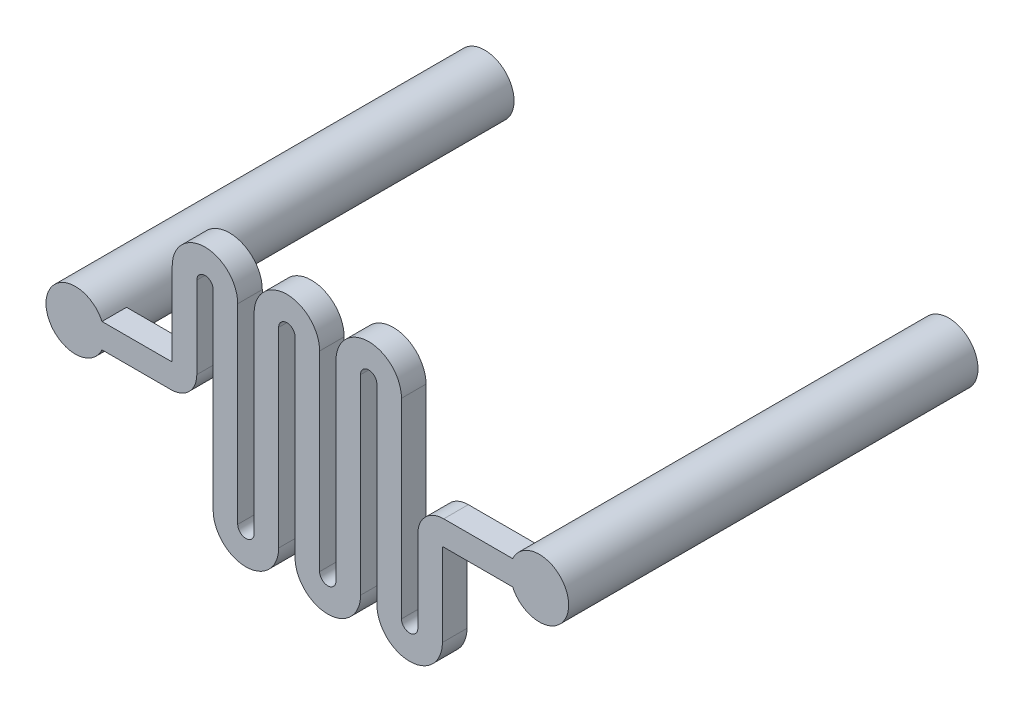
from build123d import *

# Parameters (mm, degrees)
BOSS_EXTRUDE1_DEPTH = 1.8
SKETCH3_W           = 2.15
SKETCH3_H           = 30
SKETCH4_W           = 2.15
SKETCH4_H           = 30
SKETCH5_R           = 1.5
CUT_EXTRUDE1_DEPTH  = 28


with BuildPart() as part:
    # Sketch2 → Boss-Extrude1 (new body)
    with BuildSketch(Plane.XY):
        with BuildLine():
            Line((-20.5, -0.9), (-13.5, -0.9))
            ThreePointArc((-13.5, -0.9), (-12.156497116, -0.343502884), (-11.6, 1))
            Line((-11.6, 1), (-11.6, 7))
            ThreePointArc((-11.6, 7), (-11, 7.6), (-10.4, 7))
            Line((-10.4, 7), (-10.4, 0))
            Line((-10.4, 0), (-10.4, -7))
            ThreePointArc((-10.4, -7), (-8, -9.4), (-5.6, -7))
            Line((-5.6, -7), (-5.6, 0))
            Line((-5.6, 0), (-5.6, 7))
            ThreePointArc((-5.6, 7), (-5, 7.6), (-4.4, 7))
            Line((-4.4, 7), (-4.4, 0))
            Line((-4.4, 0), (-4.4, -7))
            ThreePointArc((-4.4, -7), (-2, -9.4), (0.4, -7))
            Line((0.4, -7), (0.4, 0))
            Line((0.4, 0), (0.4, 7))
            ThreePointArc((0.4, 7), (1, 7.6), (1.6, 7))
            Line((1.6, 7), (1.6, 0))
            Line((1.6, 0), (1.6, -7))
            ThreePointArc((1.6, -7), (4, -9.4), (6.4, -7))
            Line((6.4, -7), (6.4, -1))
            ThreePointArc((6.4, -1), (6.429289322, -0.929289322), (6.5, -0.9))
            Line((6.5, -0.9), (13.5, -0.9))
            ThreePointArc((13.5, -0.9), (14.4, 0), (13.5, 0.9))
            Line((13.5, 0.9), (6.5, 0.9))
            ThreePointArc((6.5, 0.9), (5.156497116, 0.343502884), (4.6, -1))
            Line((4.6, -1), (4.6, -7))
            ThreePointArc((4.6, -7), (4, -7.6), (3.4, -7))
            Line((3.4, -7), (3.4, 0))
            Line((3.4, 0), (3.4, 7))
            ThreePointArc((3.4, 7), (1, 9.4), (-1.4, 7))
            Line((-1.4, 7), (-1.4, 0))
            Line((-1.4, 0), (-1.4, -7))
            ThreePointArc((-1.4, -7), (-2, -7.6), (-2.6, -7))
            Line((-2.6, -7), (-2.6, 0))
            Line((-2.6, 0), (-2.6, 7))
            ThreePointArc((-2.6, 7), (-5, 9.4), (-7.4, 7))
            Line((-7.4, 7), (-7.4, 0))
            Line((-7.4, 0), (-7.4, -7))
            ThreePointArc((-7.4, -7), (-8, -7.6), (-8.6, -7))
            Line((-8.6, -7), (-8.6, 0))
            Line((-8.6, 0), (-8.6, 7))
            ThreePointArc((-8.6, 7), (-11, 9.4), (-13.4, 7))
            Line((-13.4, 7), (-13.4, 1))
            ThreePointArc((-13.4, 1), (-13.429289322, 0.929289322), (-13.5, 0.9))
            Line((-13.5, 0.9), (-20.5, 0.9))
            ThreePointArc((-20.5, 0.9), (-21.4, 0), (-20.5, -0.9))
        make_face()
    extrude(amount=BOSS_EXTRUDE1_DEPTH)

    # Sketch3 → Revolve1 (revolve)
    with BuildSketch(Plane(origin=(0, 0, 0), x_dir=(1, 0, 0), z_dir=(0, 1, 0)), mode=Mode.PRIVATE) as revolve1_sk:
        with Locations((-21.575, 13.2)):
            Rectangle(SKETCH3_W, SKETCH3_H)
    revolve(revolve1_sk.sketch.rotate(Axis((-20.5, 0, 1.8), (0, 0, -1)), 180), axis=Axis((-20.5, 0, 1.8), (0, 0, -1)))

    # Sketch4 → Revolve2 (revolve)
    with BuildSketch(Plane(origin=(0, 0, 0), x_dir=(1, 0, 0), z_dir=(0, 1, 0))):
        with Locations((14.575, 13.2)):
            Rectangle(SKETCH4_W, SKETCH4_H)
    revolve(axis=Axis((13.5, 0, 1.8), (0, 0, -1)))

    # Sketch5 → Cut-Extrude1 (cut)
    with BuildSketch(Plane(origin=(0, 0, -28.2), x_dir=(-1, 0, 0), z_dir=(0, 0, -1))):
        with Locations((-13.5, 0)):
            Circle(SKETCH5_R)
        with Locations((20.5, 0)):
            Circle(SKETCH5_R)
    extrude(amount=-CUT_EXTRUDE1_DEPTH, mode=Mode.SUBTRACT)


solid = part.part
